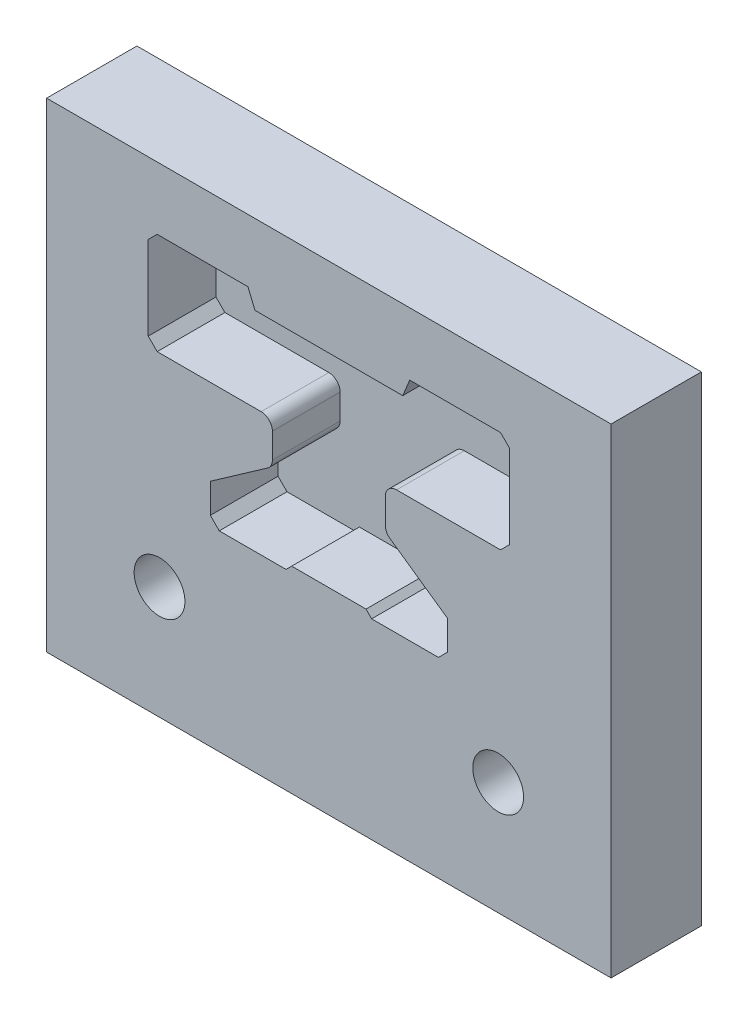
from build123d import *

# Parameters (mm, degrees)
SKETCH1_W           = 50
SKETCH1_H           = 42.5
BOSS_EXTRUDE1_DEPTH = 8
CUT_EXTRUDE1_DEPTH  = 6
SKETCH3_R           = 2.25
CUT_EXTRUDE2_DEPTH  = 34.772214911


with BuildPart() as part:
    # Sketch1 → Boss-Extrude1 (new body)
    with BuildSketch(Plane.XY):
        Rectangle(SKETCH1_W, SKETCH1_H)
    extrude(amount=BOSS_EXTRUDE1_DEPTH)

    # Sketch2 → Cut-Extrude1 (cut)
    with BuildSketch(Plane.XY.offset(8)):
        with BuildLine():
            Line((-3.292893219, -3.8), (3.292893219, -3.8))
            Line((3.292893219, -3.8), (3.792817713, -4.299924494))
            Line((3.792817713, -4.299924494), (9.707031275, -4.299924494))
            Line((9.707031275, -4.299924494), (10.499848989, -3.507106781))
            Line((10.499848989, -3.507106781), (10.499848989, -0.890716475))
            Line((10.499848989, -0.890716475), (5.426401458, 2.661749731))
            ThreePointArc((5.426401458, 2.661749731), (5.112967061, 3.019153162), (4.999977894, 3.480901775))
            Line((4.999977894, 3.480901775), (4.999977894, 5.699901775))
            ThreePointArc((4.999977894, 5.699901775), (5.292871113, 6.407008557), (5.999977894, 6.699901775))
            Line((5.999977894, 6.699901775), (15.207084675, 6.699901775))
            Line((15.207084675, 6.699901775), (15.999902388, 7.492719488))
            Line((15.999902388, 7.492719488), (15.999902388, 14.906933051))
            Line((15.999902388, 14.906933051), (15.207084675, 15.699750764))
            Line((15.207084675, 15.699750764), (7.165888575, 15.699750764))
            Line((7.165888575, 15.699750764), (6.544410681, 14.199370403))
            Line((6.544410681, 14.199370403), (-6.544410681, 14.199370403))
            Line((-6.544410681, 14.199370403), (-7.165888575, 15.699750764))
            Line((-7.165888575, 15.699750764), (-15.207084675, 15.699750764))
            Line((-15.207084675, 15.699750764), (-15.999902388, 14.906933051))
            Line((-15.999902388, 14.906933051), (-15.999902388, 7.492719488))
            Line((-15.999902388, 7.492719488), (-15.207084675, 6.699901775))
            Line((-15.207084675, 6.699901775), (-5.999977894, 6.699901775))
            ThreePointArc((-5.999977894, 6.699901775), (-5.292871113, 6.407008557), (-4.999977894, 5.699901775))
            Line((-4.999977894, 5.699901775), (-4.999977894, 3.480901775))
            ThreePointArc((-4.999977894, 3.480901775), (-5.112967061, 3.019153162), (-5.426401458, 2.661749731))
            Line((-5.426401458, 2.661749731), (-10.499848989, -0.890716475))
            Line((-10.499848989, -0.890716475), (-10.499848989, -3.507106781))
            Line((-10.499848989, -3.507106781), (-9.707031275, -4.299924494))
            Line((-9.707031275, -4.299924494), (-3.792817713, -4.299924494))
            Line((-3.792817713, -4.299924494), (-3.292893219, -3.8))
        make_face()
    extrude(amount=-CUT_EXTRUDE1_DEPTH, mode=Mode.SUBTRACT)

    # Sketch3 → Cut-Extrude2 (cut, through all)
    with BuildSketch(Plane.XY.offset(8)):
        with Locations((-15, -11.25)):
            Circle(SKETCH3_R)
        with Locations((15, -11.25)):
            Circle(SKETCH3_R)
    extrude(amount=-CUT_EXTRUDE2_DEPTH, mode=Mode.SUBTRACT)


solid = part.part
